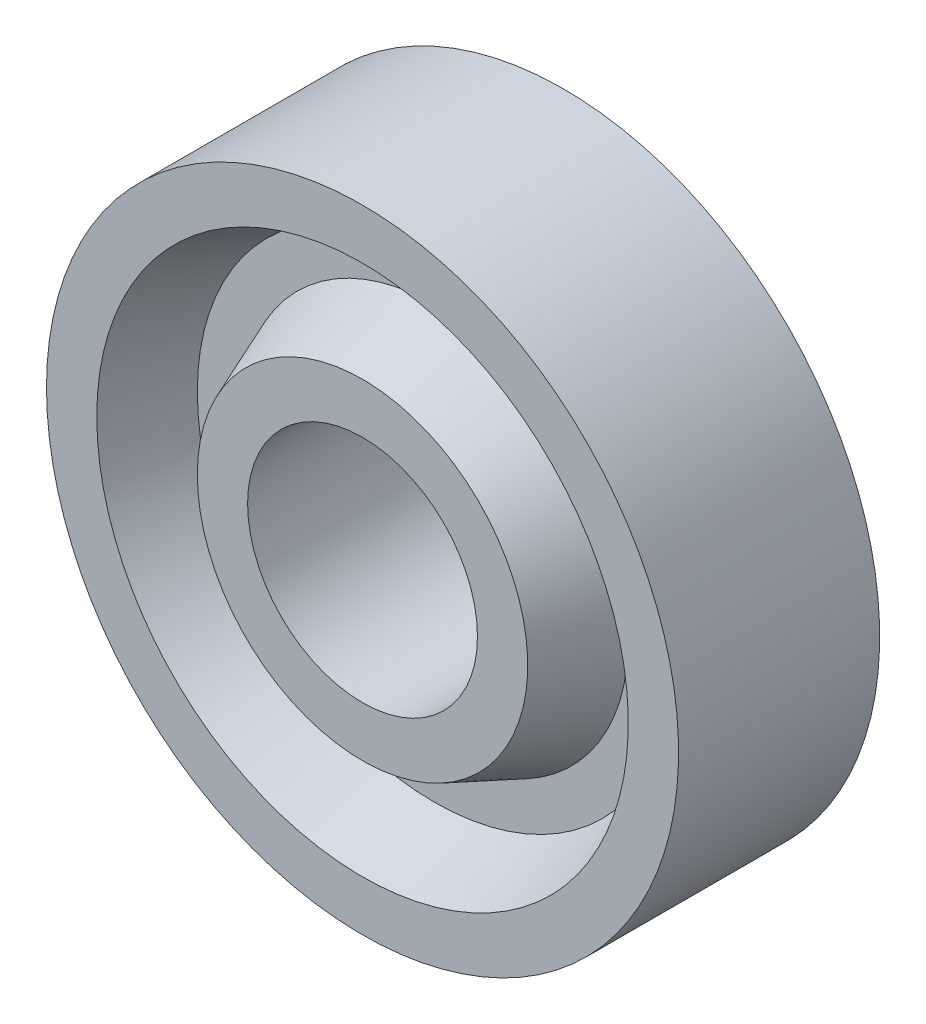
from build123d import *


with BuildPart() as part:
    # Sketch1 → Revolve1 (revolve)
    with BuildSketch(Plane(origin=(0, 0, 0), x_dir=(1, 0, 0), z_dir=(0, 1, 0)), mode=Mode.PRIVATE) as revolve1_sk:
        Polygon((5.75, 3.5), (6.75, 1), (8.25, 1), (9.25, 3.5), (11, 3.5), (11, -3.5), (9.25, -3.5), (8.25, -1), (6.75, -1), (5.75, -3.5), (4, -3.5), (4, 3.5), align=None)
    revolve(revolve1_sk.sketch.rotate(Axis((0, 0, -28.911106653), (0, 0, 1)), 180), axis=Axis((0, 0, -28.911106653), (0, 0, 1)))


solid = part.part
